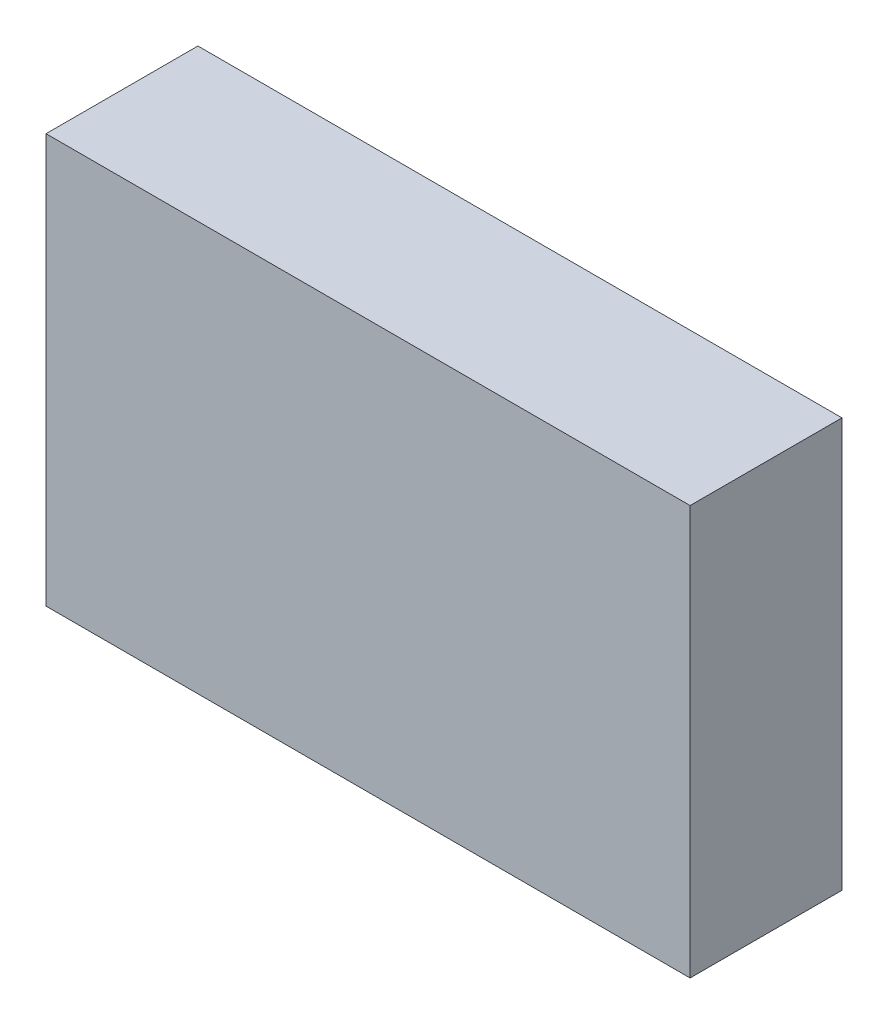
from build123d import *

# Parameters (mm, degrees)
SKETCH_1_W      = 42.408551548
SKETCH_1_H      = 26.941903336
EXTRUDE_1_DEPTH = 10


with BuildPart() as part:
    # 草图1 → 凸台-拉伸1 (new body)
    with BuildSketch(Plane.XY):
        with Locations((2.245158611, 0.748386204)):
            Rectangle(SKETCH_1_W, SKETCH_1_H)
    extrude(amount=EXTRUDE_1_DEPTH)


solid = part.part
